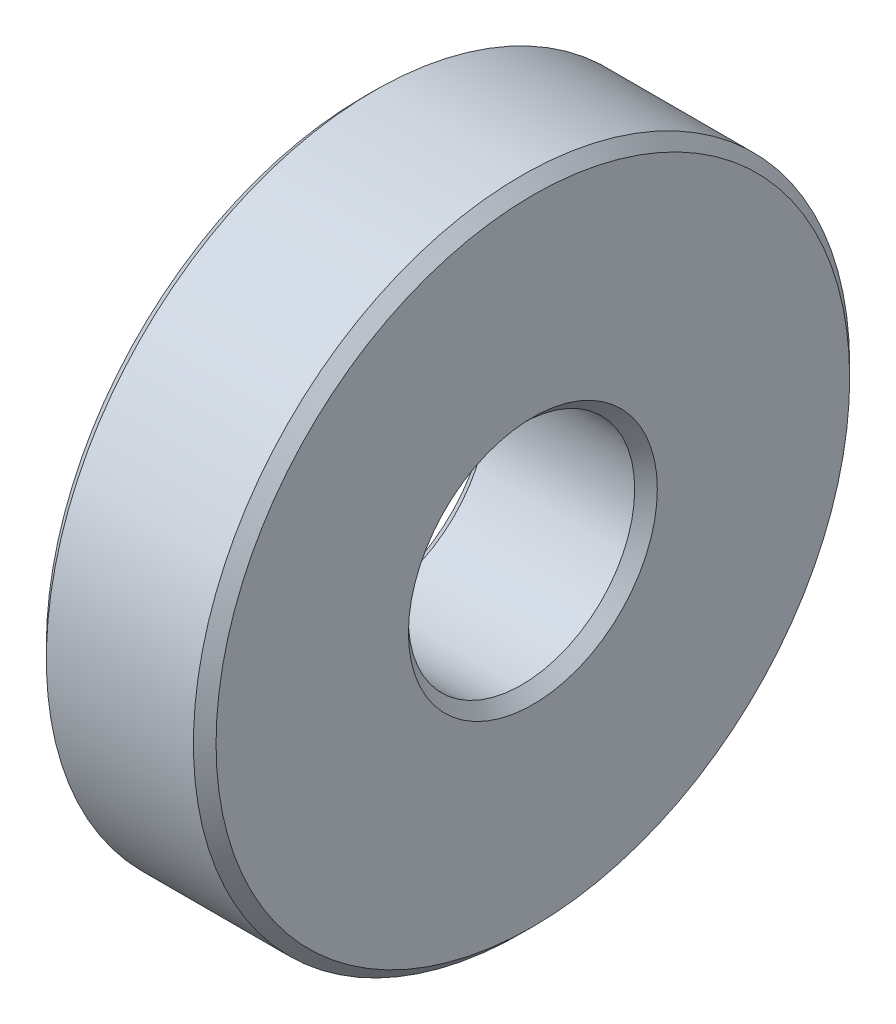
from build123d import *

# Parameters (mm, degrees)
CROQUIS1_R              = 2.9
CROQUIS1_R_2            = 1
SALIENTE_EXTRUIR1_DEPTH = 1.5
CHAFL_N1_SIZE           = 0.1


with BuildPart() as part:
    # Croquis1 → Saliente-Extruir1 (new body)
    with BuildSketch(Plane(origin=(0, 0, 0), x_dir=(0, 0, -1), z_dir=(1, 0, 0))):
        Circle(CROQUIS1_R)
        Circle(CROQUIS1_R_2, mode=Mode.SUBTRACT)
    extrude(amount=SALIENTE_EXTRUIR1_DEPTH)

    # Chaflán1
    chafl_n1_edges = [part.edges().sort_by_distance(p)[0] for p in [
        (0, 0, 2.9),
        (1.5, 0, 2.9),
        (0, 0, 1),
        (1.5, 0, 1),
    ]]
    chamfer(chafl_n1_edges, length=CHAFL_N1_SIZE)


solid = part.part
